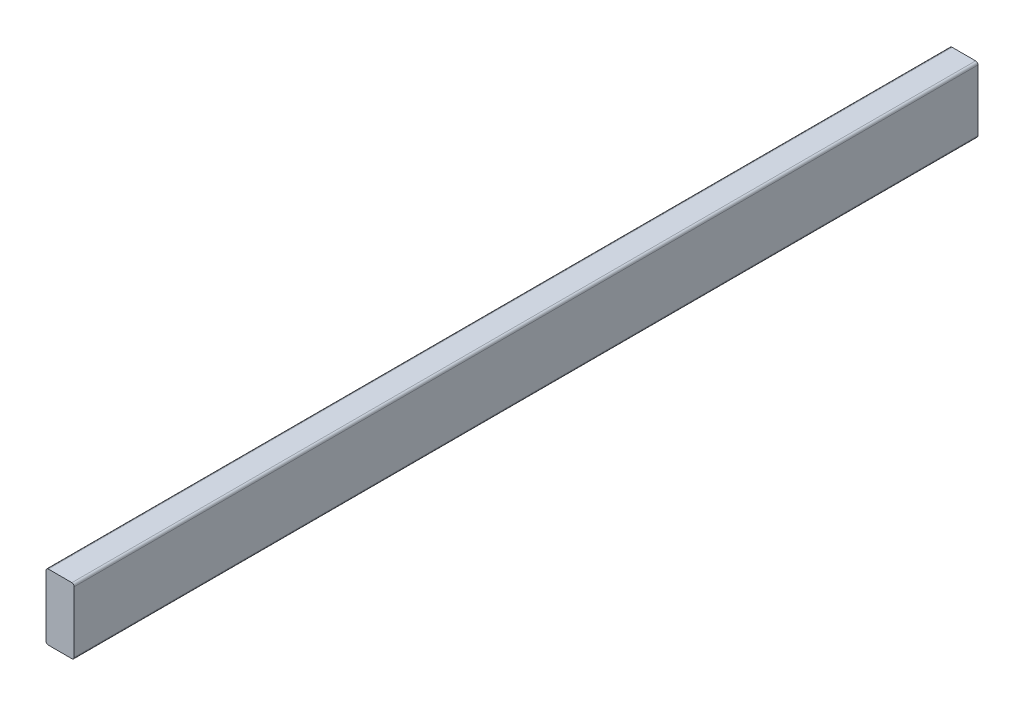
from build123d import *

# Parameters (mm, degrees)
SKETCH1_W           = 38.1
SKETCH1_H           = 88.9
BOSS_EXTRUDE1_DEPTH = 1219.2
FILLET1_R           = 3.175


with BuildPart() as part:
    # Sketch1 → Boss-Extrude1 (new body)
    with BuildSketch(Plane.XY):
        Rectangle(SKETCH1_W, SKETCH1_H)
    extrude(amount=BOSS_EXTRUDE1_DEPTH)

    # Fillet1
    fillet1_edges = [part.edges().sort_by_distance(p)[0] for p in [
        (19.05, -44.45, 609.6),
        (-19.05, -44.45, 609.6),
        (-19.05, 44.45, 609.6),
        (19.05, 44.45, 609.6),
    ]]
    fillet(fillet1_edges, radius=FILLET1_R)


solid = part.part
